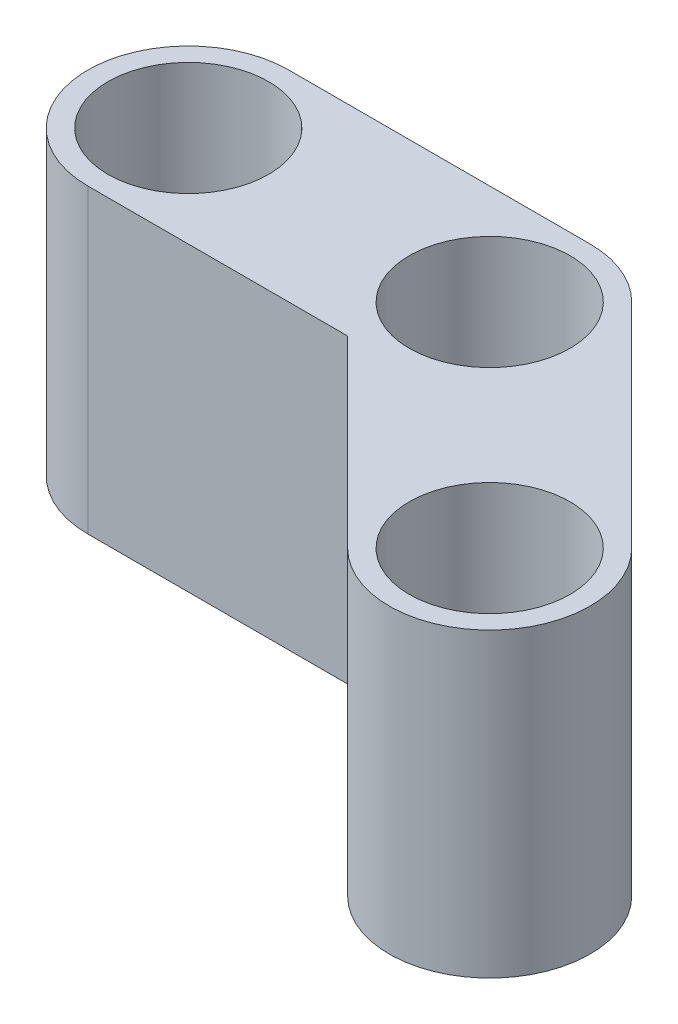
from build123d import *

# Parameters (mm, degrees)
SKETCH1_R           = 0.4
BOSS_EXTRUDE1_DEPTH = 1.5


with BuildPart() as part:
    # Sketch1 → Boss-Extrude1 (new body)
    # profile 1 of 3: a face of its own
    with BuildSketch(Plane(origin=(0, 0, 0), x_dir=(1, 0, 0), z_dir=(0, 1, 0))):
        with BuildLine():
            ThreePointArc((-10.729159454, 26.707979083), (-10.891371129, 26.816365459), (-11.082712845, 26.854425692))
            ThreePointArc((-11.082712845, 26.854425692), (-11.544652611, 26.545767409), (-11.436266235, 26.000872302))
            Line((-11.436266235, 26.000872302), (-11.289819626, 25.854425692))
            Line((-11.289819626, 25.854425692), (-11.082712845, 25.854425692))
            ThreePointArc((-11.082712845, 25.854425692), (-10.620773079, 26.163083976), (-10.729159454, 26.707979083))
        make_face()
        with Locations(Location((-11.082712845, 26.354425692, 0), (0, 0, 270))):
            Circle(SKETCH1_R, mode=Mode.SUBTRACT)
    # profile 2 of 3: a face of its own
    with BuildSketch(Plane(origin=(0, 0, 0), x_dir=(1, 0, 0), z_dir=(0, 1, 0))):
        with BuildLine():
            Line((-11.082712845, 26.854425692), (-12.582712845, 26.854425692))
            ThreePointArc((-12.582712845, 26.854425692), (-13.082712845, 26.354425692), (-12.582712845, 25.854425692))
            Line((-12.582712845, 25.854425692), (-11.289819626, 25.854425692))
            Line((-11.289819626, 25.854425692), (-11.436266235, 26.000872302))
            ThreePointArc((-11.436266235, 26.000872302), (-11.544652611, 26.545767409), (-11.082712845, 26.854425692))
        make_face()
        with Locations(Location((-12.582712845, 26.354425692, 0), (0, 0, 270))):
            Circle(SKETCH1_R, mode=Mode.SUBTRACT)
    # profile 3 of 3: a face of its own
    with BuildSketch(Plane(origin=(0, 0, 0), x_dir=(1, 0, 0), z_dir=(0, 1, 0))):
        with BuildLine():
            Line((-9.668499282, 25.647318911), (-10.729159454, 26.707979083))
            ThreePointArc((-10.729159454, 26.707979083), (-10.620773079, 26.163083976), (-11.082712845, 25.854425692))
            Line((-11.082712845, 25.854425692), (-11.289819626, 25.854425692))
            Line((-11.289819626, 25.854425692), (-10.375606064, 24.94021213))
            ThreePointArc((-10.375606064, 24.94021213), (-9.668499282, 24.94021213), (-9.668499282, 25.647318911))
        make_face()
        with Locations(Location((-10.022052673, 25.293765521, 0), (0, 0, 270))):
            Circle(SKETCH1_R, mode=Mode.SUBTRACT)
    extrude(amount=BOSS_EXTRUDE1_DEPTH)


solid = part.part
